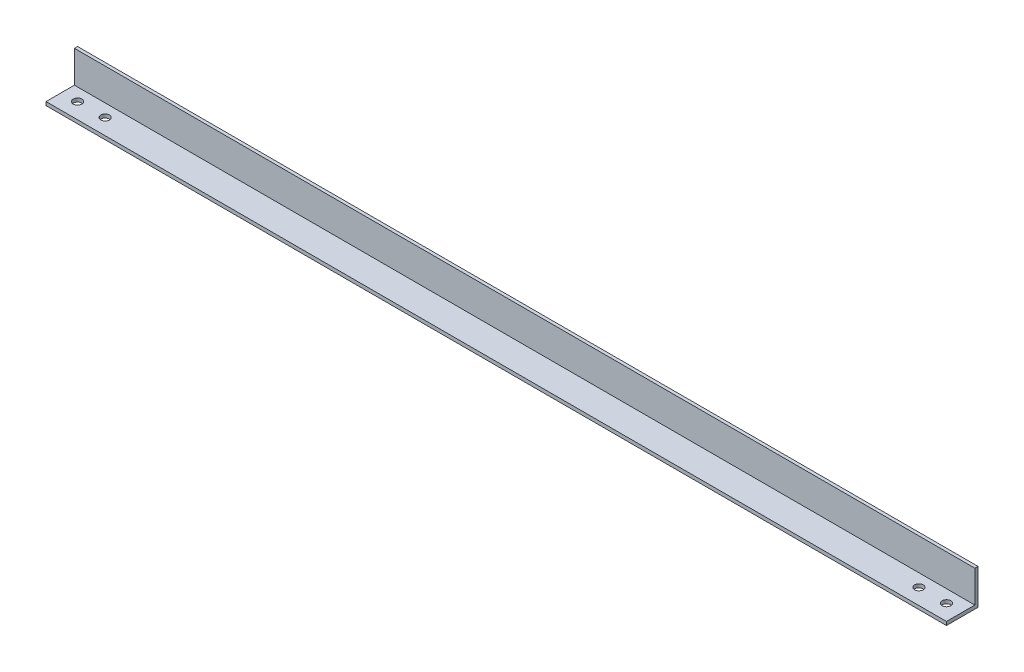
from build123d import *

# Parameters (mm, degrees)
SKETCH_174_W        = 2284
SKETCH_174_H        = 90
EXTRUDE_4_DEPTH     = 8
SKETCH_3_W          = 2284
SKETCH_3_H          = 9
EXTRUDE_5_DEPTH     = 72
SKETCH_4_R          = 11
CUT_EXTRUDE_2_DEPTH = 2287.835586569


with BuildPart() as part:
    # Sketch 174 → 拉伸4 (new body)
    with BuildSketch(Plane.XY):
        with Locations((1142, 45)):
            Rectangle(SKETCH_174_W, SKETCH_174_H)
    extrude(amount=EXTRUDE_4_DEPTH)

    # 草图3 → 拉伸5 (add)
    with BuildSketch(Plane.XY.offset(8)):
        with Locations((1142, 4.5)):
            Rectangle(SKETCH_3_W, SKETCH_3_H)
    extrude(amount=EXTRUDE_5_DEPTH)

    # 草图4 → 切除-拉伸2 (cut, through all)
    with BuildSketch(Plane(origin=(0, 9, 0), x_dir=(1, 0, 0), z_dir=(0, 1, 0))):
        with Locations(Location((39.95, -40, 0), (0, 0, 270))):
            Circle(SKETCH_4_R)
        with Locations(Location((109.95, -40, 0), (0, 0, 270))):
            Circle(SKETCH_4_R)
        with Locations(Location((2174.05, -40, 0), (0, 0, 270))):
            Circle(SKETCH_4_R)
        with Locations(Location((2244.05, -40, 0), (0, 0, 270))):
            Circle(SKETCH_4_R)
    extrude(amount=-CUT_EXTRUDE_2_DEPTH, mode=Mode.SUBTRACT)


solid = part.part
